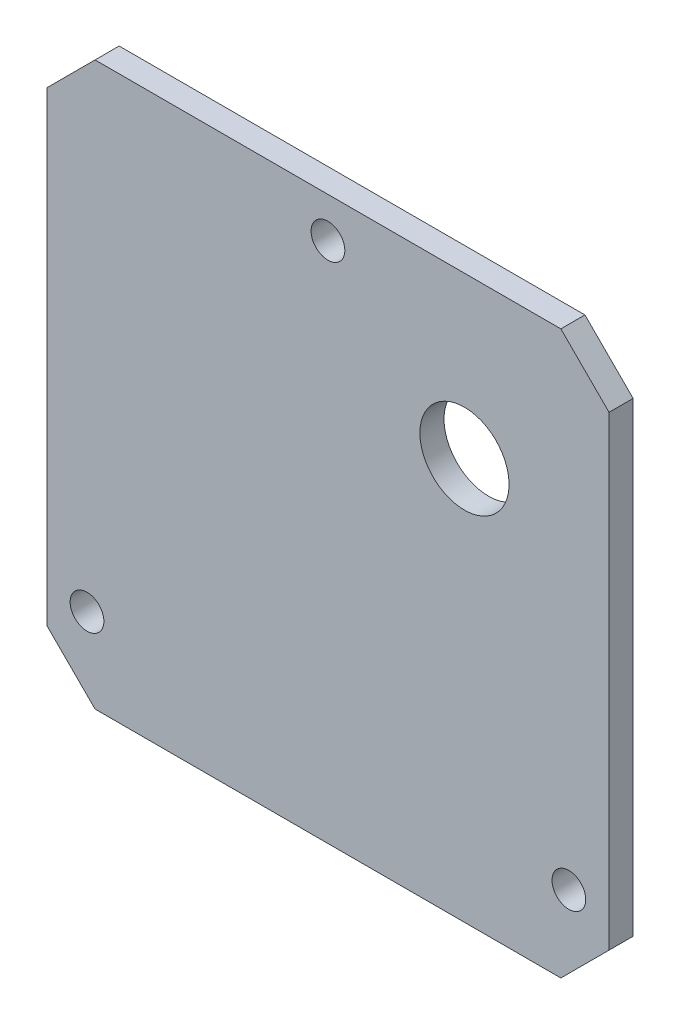
from build123d import *

# Parameters (mm, degrees)
SKETCH_1_W          = 70
SKETCH_1_H          = 70
EXTRUDE_1_DEPTH     = 3
CHAMFER_1_SIZE      = 6
SKETCH_2_R          = 2.1
CUT_EXTRUDE_1_DEPTH = 50.588305073
SKETCH_3_R          = 5.55
CUT_EXTRUDE_2_DEPTH = 50.588305073


with BuildPart() as part:
    # 草圖1 → 填料-伸長1 (new body)
    with BuildSketch(Plane.XY):
        Rectangle(SKETCH_1_W, SKETCH_1_H)
    extrude(amount=EXTRUDE_1_DEPTH)

    # 導角1
    chamfer_1_edges = [part.edges().sort_by_distance(p)[0] for p in [
        (-35, 35, 1.5),
        (35, 35, 1.5),
        (35, -35, 1.5),
        (-35, -35, 1.5),
    ]]
    chamfer(chamfer_1_edges, length=CHAMFER_1_SIZE)

    # 草圖2 → 除料-伸長1 (cut, through all)
    with BuildSketch(Plane(origin=(0, 0, 0), x_dir=(-1, 0, 0), z_dir=(0, 0, -1))):
        with Locations((0, 30)):
            Circle(SKETCH_2_R)
        with Locations((-30, -25)):
            Circle(SKETCH_2_R)
        with Locations((30, -25)):
            Circle(SKETCH_2_R)
    extrude(amount=-CUT_EXTRUDE_1_DEPTH, mode=Mode.SUBTRACT)

    # 草圖3 → 除料-伸長2 (cut, through all)
    with BuildSketch(Plane(origin=(0, 0, 0), x_dir=(-1, 0, 0), z_dir=(0, 0, -1))):
        with Locations((-17, 15)):
            Circle(SKETCH_3_R)
    extrude(amount=-CUT_EXTRUDE_2_DEPTH, mode=Mode.SUBTRACT)


solid = part.part
